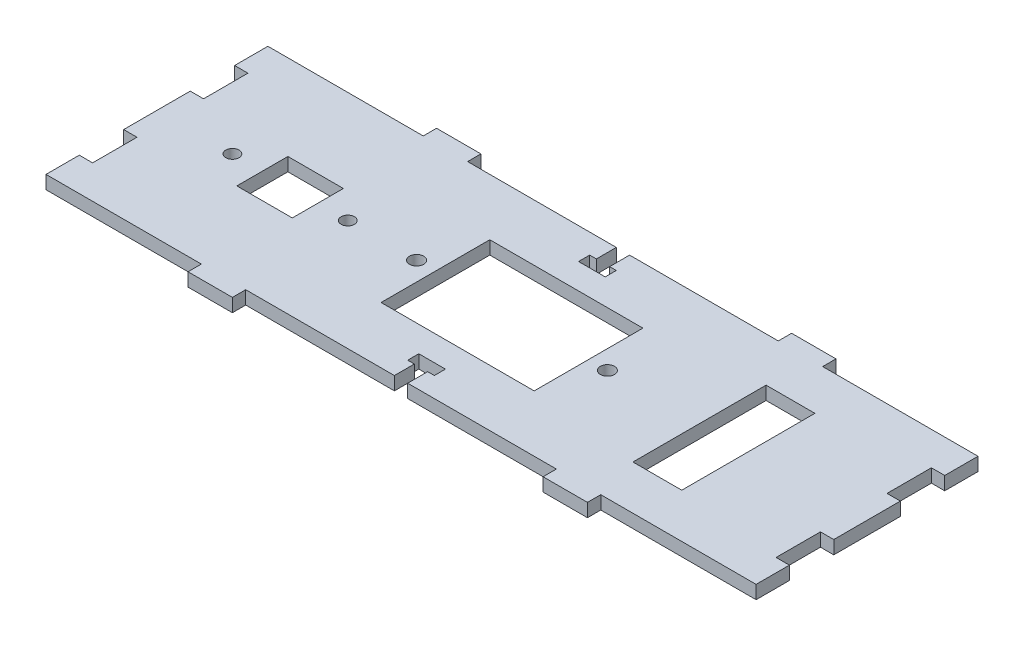
from build123d import *

# Parameters (mm, degrees)
SKETCH3_W           = 160
SKETCH3_H           = 56
BOSS_EXTRUDE1_DEPTH = 3
SKETCH4_W           = 3
SKETCH4_H           = 10
SKETCH4_W_2         = 35
SKETCH4_H_2         = 3
CUT_EXTRUDE1_DEPTH  = 85.811555816
SKETCH5_R           = 1.6
SKETCH5_R_2         = 1.5
SKETCH5_W           = 34.5
SKETCH5_H           = 24.5
SKETCH5_W_2         = 11
SKETCH5_H_2         = 30
SKETCH5_W_3         = 12.5
SKETCH5_H_3         = 11.5
CUT_EXTRUDE2_DEPTH  = 85.811555816


with BuildPart() as part:
    # Sketch3 → Boss-Extrude1 (new body)
    with BuildSketch(Plane(origin=(0, 0, 0), x_dir=(1, 0, 0), z_dir=(0, 1, 0))):
        Rectangle(SKETCH3_W, SKETCH3_H)
    extrude(amount=BOSS_EXTRUDE1_DEPTH)

    # Sketch4 → Cut-Extrude1 (cut, through all)
    with BuildSketch(Plane(origin=(0, 3, 0), x_dir=(1, 0, 0), z_dir=(0, 1, 0))):
        with Locations((-78.5, 12.5)):
            Rectangle(SKETCH4_W, SKETCH4_H)
        Polygon((-35, 28), (-35, 25), (-1.5, 25), (-1.5, 20.5), (-3, 20.5), (-3, 18), (3, 18), (3, 20.5), (1.5, 20.5), (1.5, 25), (35, 25), (35, 28), align=None)
        with Locations((-62.5, 26.5)):
            Rectangle(SKETCH4_W_2, SKETCH4_H_2)
        with Locations((62.5, 26.5)):
            Rectangle(SKETCH4_W_2, SKETCH4_H_2)
        with Locations((78.5, 12.5)):
            Rectangle(SKETCH4_W, SKETCH4_H)
        with Locations((78.5, -12.5)):
            Rectangle(SKETCH4_W, SKETCH4_H)
        with Locations((62.5, -26.5)):
            Rectangle(SKETCH4_W_2, SKETCH4_H_2)
        Polygon((35, -28), (-35, -28), (-35, -25), (-1.5, -25), (-1.5, -20.5), (-3, -20.5), (-3, -18), (3, -18), (3, -20.5), (1.5, -20.5), (1.5, -25), (35, -25), align=None)
        with Locations((-62.5, -26.5)):
            Rectangle(SKETCH4_W_2, SKETCH4_H_2)
        with Locations((-78.5, -12.5)):
            Rectangle(SKETCH4_W, SKETCH4_H)
    extrude(amount=-CUT_EXTRUDE1_DEPTH, mode=Mode.SUBTRACT)

    # Sketch5 → Cut-Extrude2 (cut, through all)
    with BuildSketch(Plane(origin=(0, 3, 0), x_dir=(1, 0, 0), z_dir=(0, 1, 0))):
        with Locations(Location((-21.5, 0, 0), (0, 0, 270))):
            Circle(SKETCH5_R)
        with Locations(Location((21.5, 0, 0), (0, 0, 90))):
            Circle(SKETCH5_R)
        with Locations(Location((-63, 0, 0), (0, 0, 270))):
            Circle(SKETCH5_R_2)
        with Locations(Location((-37, 0, 0), (0, 0, 90))):
            Circle(SKETCH5_R_2)
        Rectangle(SKETCH5_W, SKETCH5_H)
        with Locations((47.75, 0)):
            Rectangle(SKETCH5_W_2, SKETCH5_H_2)
        with Locations((-50, 0)):
            Rectangle(SKETCH5_W_3, SKETCH5_H_3)
    extrude(amount=-CUT_EXTRUDE2_DEPTH, mode=Mode.SUBTRACT)


solid = part.part
